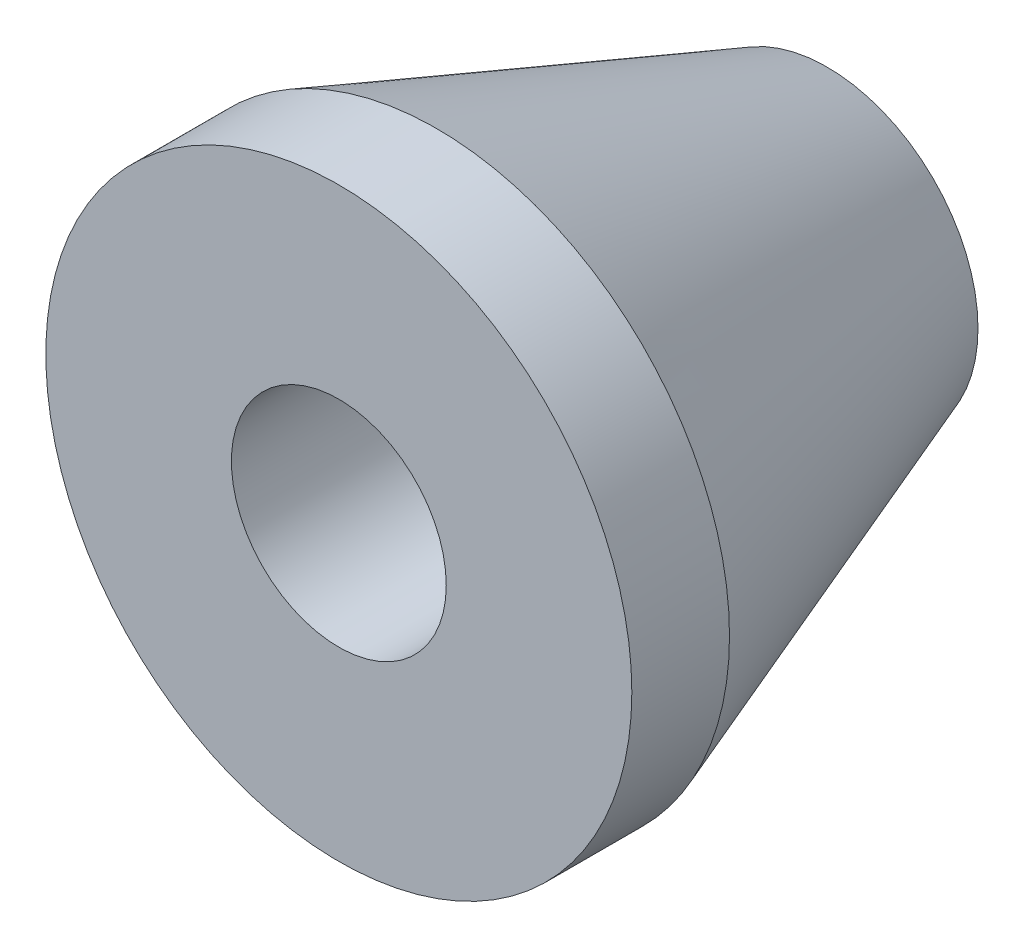
from build123d import *


with BuildPart() as part:
    # Sketch1 → Revolve1 (revolve)
    with BuildSketch(Plane(origin=(0, 0, 0), x_dir=(0, 0, -1), z_dir=(1, 0, 0)), mode=Mode.PRIVATE) as revolve1_sk:
        Polygon((0, 11), (0, 30), (10, 30), (50, 15.441190629), (50, 11), align=None)
    revolve(revolve1_sk.sketch.rotate(Axis((0, 0, 33.810937322), (0, 0, -1)), 90), axis=Axis((0, 0, 33.810937322), (0, 0, -1)))


solid = part.part
